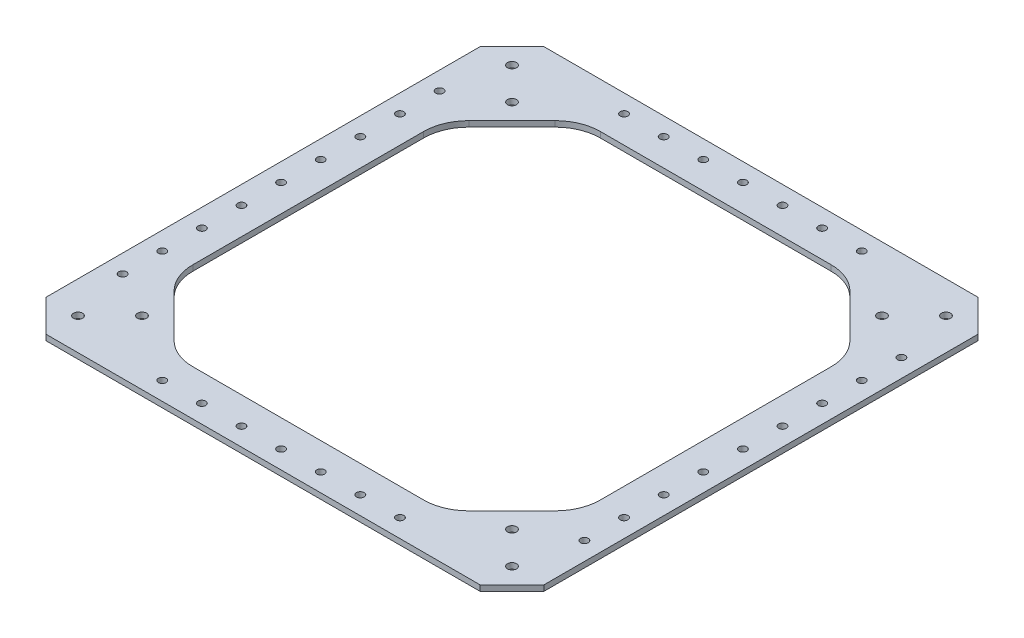
from build123d import *

# Parameters (mm, degrees)
BOSS_EXTRUDE1_DEPTH = 3.175
CUT_EXTRUDE4_DEPTH  = 235.179100055
SKETCH5_R           = 2.54
CUT_EXTRUDE3_DEPTH  = 235.179100055
SKETCH4_R           = 2.159
CUT_EXTRUDE2_DEPTH  = 235.179100055
FILLET1_R           = 25.4


with BuildPart() as part:
    # Sketch1 → Boss-Extrude1 (new body)
    with BuildSketch(Plane(origin=(0, 0, 0), x_dir=(1, 0, 0), z_dir=(0, 1, 0))):
        Polygon((-139.7, 73.520142619), (-121.739487758, 91.480654861), (121.739487758, 91.480654861), (139.7, 73.520142619), (139.7, -169.958832897), (121.739487758, -187.919345139), (-121.739487758, -187.919345139), (-139.7, -169.958832897), align=None)
    extrude(amount=BOSS_EXTRUDE1_DEPTH)

    # Sketch2 → Cut-Extrude4 (cut, through all)
    with BuildSketch(Plane(origin=(0, 3.175, 0), x_dir=(1, 0, 0), z_dir=(0, 1, 0))):
        Polygon((-103.778975516, 37.599118134), (-114.3, 27.07809365), (-114.3, -123.516783928), (-103.778975516, -134.037808413), (-85.818463274, -151.998320655), (-75.297438789, -162.519345139), (75.297438789, -162.519345139), (85.818463274, -151.998320655), (103.778975516, -134.037808413), (114.3, -123.516783928), (114.3, 27.07809365), (103.778975516, 37.599118134), (85.818463274, 55.559630377), (75.297438789, 66.080654861), (-75.297438789, 66.080654861), (-85.818463274, 55.559630377), align=None)
    extrude(amount=-CUT_EXTRUDE4_DEPTH, mode=Mode.SUBTRACT)

    # Sketch5 → Cut-Extrude3 (cut, through all)
    with BuildSketch(Plane(origin=(0, 3.175, 0), x_dir=(1, 0, 0), z_dir=(0, 1, 0))):
        with Locations(Location((-121.739487758, 73.520142619, 0), (0, 0, 270))):
            Circle(SKETCH5_R)
        with Locations(Location((-103.778975516, 55.559630377, 0), (0, 0, 270))):
            Circle(SKETCH5_R)
        with Locations(Location((103.778975516, 55.559630377, 0), (0, 0, 90))):
            Circle(SKETCH5_R)
        with Locations(Location((121.739487758, 73.520142619, 0), (0, 0, 90))):
            Circle(SKETCH5_R)
        with Locations(Location((121.739487758, -169.958832897, 0), (0, 0, 270))):
            Circle(SKETCH5_R)
        with Locations(Location((103.778975516, -151.998320655, 0), (0, 0, 270))):
            Circle(SKETCH5_R)
        with Locations(Location((-103.778975516, -151.998320655, 0), (0, 0, 90))):
            Circle(SKETCH5_R)
        with Locations(Location((-121.739487758, -169.958832897, 0), (0, 0, 90))):
            Circle(SKETCH5_R)
    extrude(amount=-CUT_EXTRUDE3_DEPTH, mode=Mode.SUBTRACT)

    # Sketch4 → Cut-Extrude2 (cut, through all)
    with BuildSketch(Plane(origin=(0, 3.175, 0), x_dir=(1, 0, 0), z_dir=(0, 1, 0))):
        with Locations(Location((0, 81.320654861, 0), (0, 0, 270))):
            Circle(SKETCH4_R)
        with Locations(Location((-44.45, 81.320654861, 0), (0, 0, 270))):
            Circle(SKETCH4_R)
        with Locations(Location((44.45, 81.320654861, 0), (0, 0, 270))):
            Circle(SKETCH4_R)
        with Locations(Location((-22.225, 81.320654861, 0), (0, 0, 270))):
            Circle(SKETCH4_R)
        with Locations(Location((22.225, 81.320654861, 0), (0, 0, 270))):
            Circle(SKETCH4_R)
        with Locations(Location((-129.54, -48.219345139, 0), (0, 0, 270))):
            Circle(SKETCH4_R)
        with Locations(Location((-129.54, -25.994345139, 0), (0, 0, 270))):
            Circle(SKETCH4_R)
        with Locations(Location((-129.54, -3.769345139, 0), (0, 0, 270))):
            Circle(SKETCH4_R)
        with Locations(Location((129.54, -48.219345139, 0), (0, 0, 270))):
            Circle(SKETCH4_R)
        with Locations(Location((129.54, -25.994345139, 0), (0, 0, 270))):
            Circle(SKETCH4_R)
        with Locations(Location((129.54, -3.769345139, 0), (0, 0, 270))):
            Circle(SKETCH4_R)
        with Locations(Location((129.54, -92.669345139, 0), (0, 0, 90))):
            Circle(SKETCH4_R)
        with Locations(Location((129.54, -70.444345139, 0), (0, 0, 90))):
            Circle(SKETCH4_R)
        with Locations(Location((-129.54, -92.669345139, 0), (0, 0, 90))):
            Circle(SKETCH4_R)
        with Locations(Location((-129.54, -70.444345139, 0), (0, 0, 90))):
            Circle(SKETCH4_R)
        with Locations(Location((22.225, -177.759345139, 0), (0, 0, 90))):
            Circle(SKETCH4_R)
        with Locations(Location((-22.225, -177.759345139, 0), (0, 0, 90))):
            Circle(SKETCH4_R)
        with Locations(Location((44.45, -177.759345139, 0), (0, 0, 90))):
            Circle(SKETCH4_R)
        with Locations(Location((-44.45, -177.759345139, 0), (0, 0, 90))):
            Circle(SKETCH4_R)
        with Locations(Location((0, -177.759345139, 0), (0, 0, 90))):
            Circle(SKETCH4_R)
        with Locations(Location((-66.675, 81.320654861, 0), (0, 0, 270))):
            Circle(SKETCH4_R)
        with Locations(Location((66.675, 81.320654861, 0), (0, 0, 270))):
            Circle(SKETCH4_R)
        with Locations(Location((-129.54, 18.455654861, 0), (0, 0, 270))):
            Circle(SKETCH4_R)
        with Locations(Location((129.54, 18.455654861, 0), (0, 0, 270))):
            Circle(SKETCH4_R)
        with Locations(Location((129.54, -114.894345139, 0), (0, 0, 90))):
            Circle(SKETCH4_R)
        with Locations(Location((66.675, -177.759345139, 0), (0, 0, 90))):
            Circle(SKETCH4_R)
        with Locations(Location((-66.675, -177.759345139, 0), (0, 0, 90))):
            Circle(SKETCH4_R)
        with Locations(Location((-129.54, -114.894345139, 0), (0, 0, 90))):
            Circle(SKETCH4_R)
        with Locations(Location((-129.54, -137.119345139, 0), (0, 0, 270))):
            Circle(SKETCH4_R)
        with Locations(Location((-129.54, 40.680654861, 0), (0, 0, 90))):
            Circle(SKETCH4_R)
        with Locations(Location((129.54, 40.680654861, 0), (0, 0, 270))):
            Circle(SKETCH4_R)
        with Locations(Location((129.54, -137.119345139, 0), (0, 0, 90))):
            Circle(SKETCH4_R)
    extrude(amount=-CUT_EXTRUDE2_DEPTH, mode=Mode.SUBTRACT)

    # Fillet1
    fillet1_edges = [part.edges().sort_by_distance(p)[0] for p in [
        (-75.297438789, 1.5875, -66.080654861),
        (75.297438789, 1.5875, -66.080654861),
        (114.3, 1.5875, -27.07809365),
        (114.3, 1.5875, 123.516783928),
        (75.297438789, 1.5875, 162.519345139),
        (-75.297438789, 1.5875, 162.519345139),
        (-114.3, 1.5875, 123.516783928),
        (-114.3, 1.5875, -27.07809365),
    ]]
    fillet(fillet1_edges, radius=FILLET1_R)


solid = part.part
